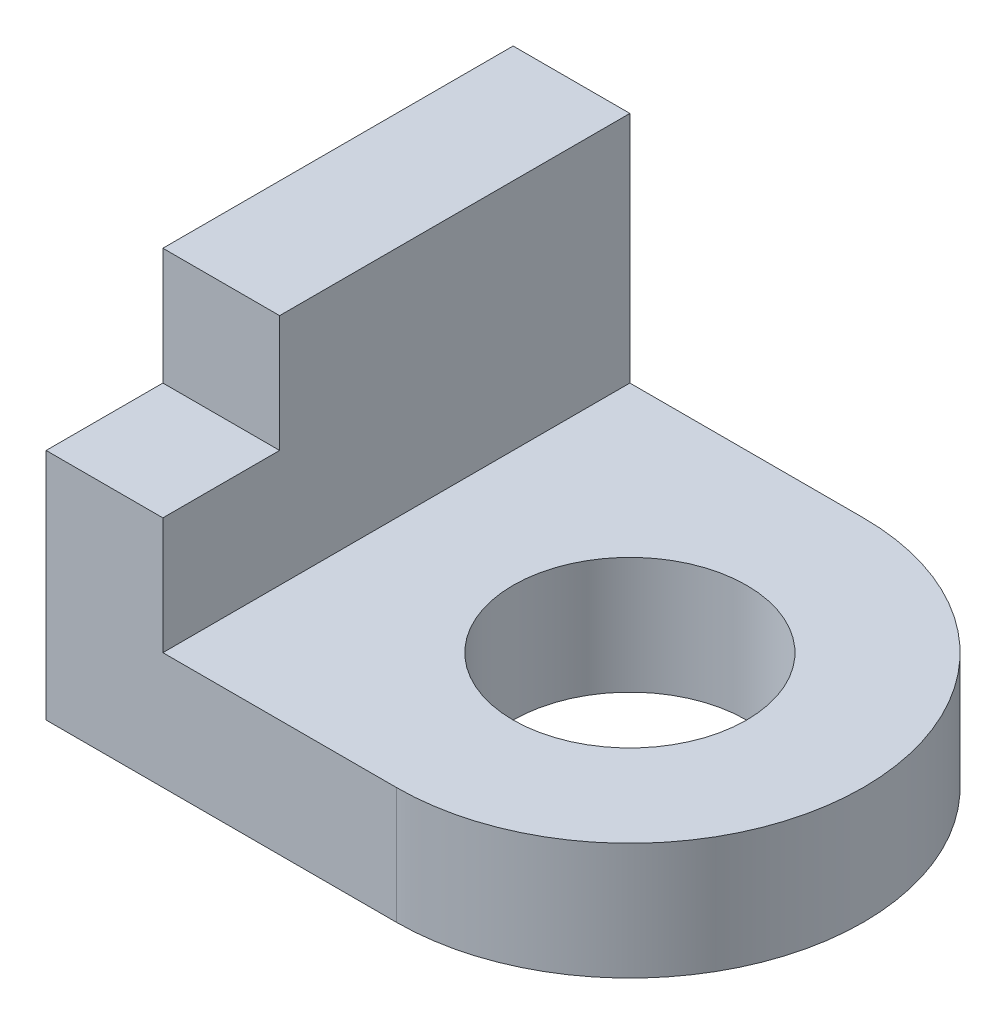
from build123d import *

# Parameters (mm, degrees)
SKETCH2_W           = 10
SKETCH2_H           = 30
BOSS_EXTRUDE1_DEPTH = 30
SKETCH2_3_W         = 10
SKETCH2_3_H         = 10
BOSS_EXTRUDE2_DEPTH = 20
SKETCH2_4_R         = 10
BOSS_EXTRUDE3_DEPTH = 10


with BuildPart() as part:
    # Sketch2 → Boss-Extrude1 (new body)
    with BuildSketch(Plane(origin=(0, 0, 0), x_dir=(1, 0, 0), z_dir=(0, 1, 0))):
        with Locations((5, 25)):
            Rectangle(SKETCH2_W, SKETCH2_H)
    extrude(amount=BOSS_EXTRUDE1_DEPTH)

    # Sketch2<3> → Boss-Extrude2 (add)
    with BuildSketch(Plane(origin=(0, 0, 0), x_dir=(1, 0, 0), z_dir=(0, 1, 0))):
        with Locations((5, 5)):
            Rectangle(SKETCH2_3_W, SKETCH2_3_H)
    extrude(amount=BOSS_EXTRUDE2_DEPTH)

    # Sketch2<4> → Boss-Extrude3 (add)
    with BuildSketch(Plane(origin=(0, 0, 0), x_dir=(1, 0, 0), z_dir=(0, 1, 0))):
        with BuildLine():
            Line((30, 40), (10, 40))
            Line((10, 40), (10, 10))
            Line((10, 10), (10, 0))
            Line((10, 0), (30, 0))
            ThreePointArc((30, 0), (50, 20), (30, 40))
        make_face()
        with Locations((30, 20)):
            Circle(SKETCH2_4_R, mode=Mode.SUBTRACT)
    extrude(amount=BOSS_EXTRUDE3_DEPTH)


solid = part.part
